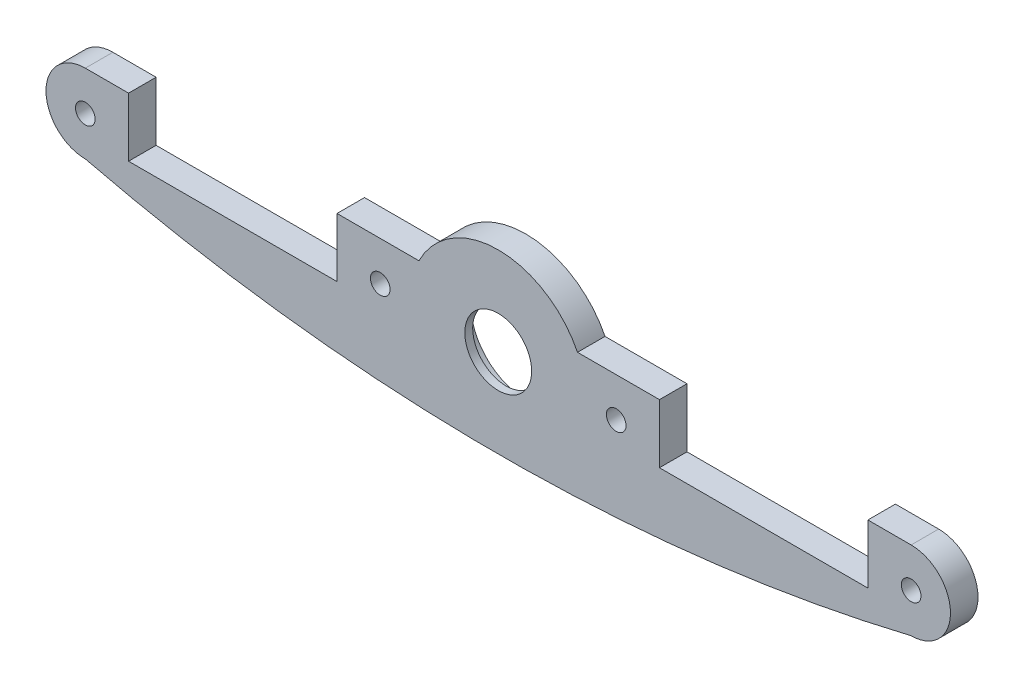
from build123d import *

# Parameters (mm, degrees)
SKETCH_1_R          = 8.5
EXTRUDE_1_DEPTH     = 7
SKETCH_3_R          = 14
CUT_EXTRUDE_2_DEPTH = 5
CUT_EXTRUDE_3_REACH = 119.389
SKETCH_4_R          = 2.5
CUT_EXTRUDE_5_REACH = 119.389
SKETCH_6_W          = 53
SKETCH_6_H          = 15
EXTRUDE_START       = -7
EXTRUDE_2_DEPTH     = 7


with BuildPart() as part:
    # 草图1 → 凸台-拉伸1 (new body)
    with BuildSketch(Plane.XY):
        with BuildLine():
            ThreePointArc((20.155644371, 10), (0, 22.5), (-20.155644371, 10))
            Line((-20.155644371, 10), (-105, 10))
            ThreePointArc((-105, 10), (-115, 0), (-105, -10))
            Line((-105, -10), (-20.155644371, -10))
            ThreePointArc((-20.155644371, -10), (0, -22.5), (20.155644371, -10))
            Line((20.155644371, -10), (105, -10))
            ThreePointArc((105, -10), (115, 0), (105, 10))
            Line((105, 10), (20.155644371, 10))
        make_face()
        Circle(SKETCH_1_R, mode=Mode.SUBTRACT)
    extrude(amount=-EXTRUDE_1_DEPTH)

    # 草图3 → 切除-拉伸2 (cut)
    with BuildSketch(Plane(origin=(0, 0, -7), x_dir=(-1, 0, 0), z_dir=(0, 0, -1))):
        Circle(SKETCH_3_R)
    extrude(amount=-CUT_EXTRUDE_2_DEPTH, mode=Mode.SUBTRACT)

    # 草图4 → 切除-拉伸3 (cut, up to next)
    with BuildSketch(Plane.XY.offset(-7), mode=Mode.PRIVATE) as cut_extrude_3_sk1:
        with Locations((30, 0)):
            Circle(SKETCH_4_R)
    cut_extrude_3_tool1 = extrude(cut_extrude_3_sk1.sketch, amount=CUT_EXTRUDE_3_REACH, mode=Mode.PRIVATE) & part.part
    # 草图4 → 切除-拉伸3 (cut, up to next)
    with BuildSketch(Plane.XY.offset(-7), mode=Mode.PRIVATE) as cut_extrude_3_sk2:
        with Locations((105, 0)):
            Circle(SKETCH_4_R)
    cut_extrude_3_tool2 = extrude(cut_extrude_3_sk2.sketch, amount=CUT_EXTRUDE_3_REACH, mode=Mode.PRIVATE) & part.part
    # 草图4 → 切除-拉伸3 (cut, up to next)
    with BuildSketch(Plane.XY.offset(-7), mode=Mode.PRIVATE) as cut_extrude_3_sk3:
        with Locations(Location((-105, 0, 0), (0, 0, 180))):
            Circle(SKETCH_4_R)
    cut_extrude_3_tool3 = extrude(cut_extrude_3_sk3.sketch, amount=CUT_EXTRUDE_3_REACH, mode=Mode.PRIVATE) & part.part
    # 草图4 → 切除-拉伸3 (cut, up to next)
    with BuildSketch(Plane.XY.offset(-7), mode=Mode.PRIVATE) as cut_extrude_3_sk4:
        with Locations(Location((-30, 0, 0), (0, 0, 180))):
            Circle(SKETCH_4_R)
    cut_extrude_3_tool4 = extrude(cut_extrude_3_sk4.sketch, amount=CUT_EXTRUDE_3_REACH, mode=Mode.PRIVATE) & part.part
    add(cut_extrude_3_tool1.solids().sort_by_distance((30, 0, -7))[0], mode=Mode.SUBTRACT)
    add(cut_extrude_3_tool2.solids().sort_by_distance((105, 0, -7))[0], mode=Mode.SUBTRACT)
    add(cut_extrude_3_tool3.solids().sort_by_distance((-105, 0, -7))[0], mode=Mode.SUBTRACT)
    add(cut_extrude_3_tool4.solids().sort_by_distance((-30, 0, -7))[0], mode=Mode.SUBTRACT)

    # 草图6 → 切除-拉伸5 (cut, up to next)
    with BuildSketch(Plane(origin=(0, 0, -7), x_dir=(-1, 0, 0), z_dir=(0, 0, -1)), mode=Mode.PRIVATE) as cut_extrude_5_sk1:
        with Locations((-67.5, 2.5)):
            Rectangle(SKETCH_6_W, SKETCH_6_H)
    cut_extrude_5_tool1 = extrude(cut_extrude_5_sk1.sketch, amount=-CUT_EXTRUDE_5_REACH, mode=Mode.PRIVATE) & part.part
    # 草图6 → 切除-拉伸5 (cut, up to next)
    with BuildSketch(Plane(origin=(0, 0, -7), x_dir=(-1, 0, 0), z_dir=(0, 0, -1)), mode=Mode.PRIVATE) as cut_extrude_5_sk2:
        with Locations((67.5, 2.5)):
            Rectangle(SKETCH_6_W, SKETCH_6_H)
    cut_extrude_5_tool2 = extrude(cut_extrude_5_sk2.sketch, amount=-CUT_EXTRUDE_5_REACH, mode=Mode.PRIVATE) & part.part
    add(cut_extrude_5_tool1.solids().sort_by_distance((67.5, 2.5, -7))[0], mode=Mode.SUBTRACT)
    add(cut_extrude_5_tool2.solids().sort_by_distance((-67.5, 2.5, -7))[0], mode=Mode.SUBTRACT)

    # 草图7 → 凸台-拉伸2 (add)
    with BuildSketch(Plane(origin=(0, 0, -7), x_dir=(-1, 0, 0), z_dir=(0, 0, -1)).offset(EXTRUDE_START)):
        with BuildLine():
            ThreePointArc((-105, -10), (-52.870714977, -19.364005631), (-4.1e-08, -22.5))
            ThreePointArc((-4.1e-08, -22.5), (-11.858541243, -19.121323165), (-20.155644371, -10))
            Line((-20.155644371, -10), (-105, -10))
        make_face()
        with BuildLine():
            Line((105, -10), (20.155644371, -10))
            ThreePointArc((20.155644371, -10), (11.858541208, -19.121323187), (-4.1e-08, -22.5))
            ThreePointArc((-4.1e-08, -22.5), (52.870714936, -19.364005636), (105, -10))
        make_face()
    extrude(amount=EXTRUDE_2_DEPTH)


solid = part.part
